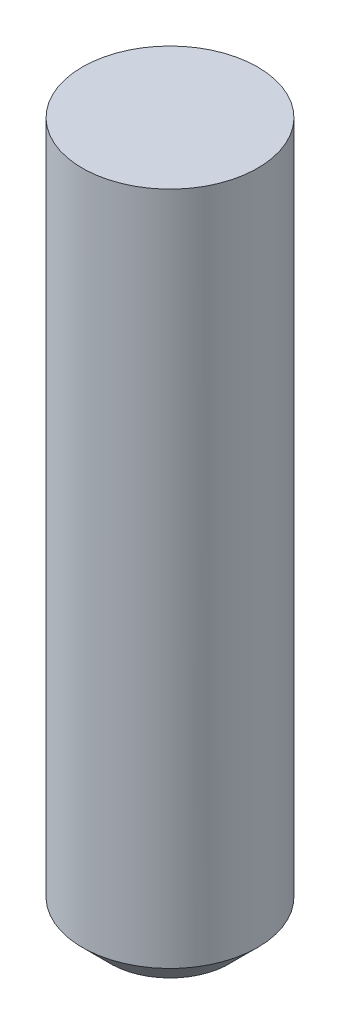
from build123d import *

# Parameters (mm, degrees)
CUT_EXTRUDE1_DEPTH      = 26.498551881
CUT_EXTRUDE1_DEPTH_BACK = 26.498551881
SKETCH2_W               = 5.569431845
SKETCH2_H               = 14.354265732


with BuildPart() as part:
    # Sketch1 → Revolve1 (revolve)
    with BuildSketch(Plane(origin=(0, 0, 0), x_dir=(-1, 0, 0), z_dir=(0, 0, -1)), mode=Mode.PRIVATE) as revolve1_sk:
        Polygon((-1.07569, 0), (0, 0), (0, 25.4), (-1.07569, 25.4), (-1.58369, 24.892), (-1.58369, 0.508), align=None)
    revolve(revolve1_sk.sketch.rotate(Axis((0, 0, 0), (0, 1, 0)), 180), axis=Axis((0, 0, 0), (0, 1, 0)))

    # Sketch2 → Cut-Extrude1 (cut, two sides: drawn at the far end of the back side and taken through both)
    with BuildSketch(Plane.XY.offset(-CUT_EXTRUDE1_DEPTH_BACK)):
        with Locations((-0.237247142, 19.877132866)):
            Rectangle(SKETCH2_W, SKETCH2_H)
    extrude(amount=CUT_EXTRUDE1_DEPTH + CUT_EXTRUDE1_DEPTH_BACK, mode=Mode.SUBTRACT)


solid = part.part
